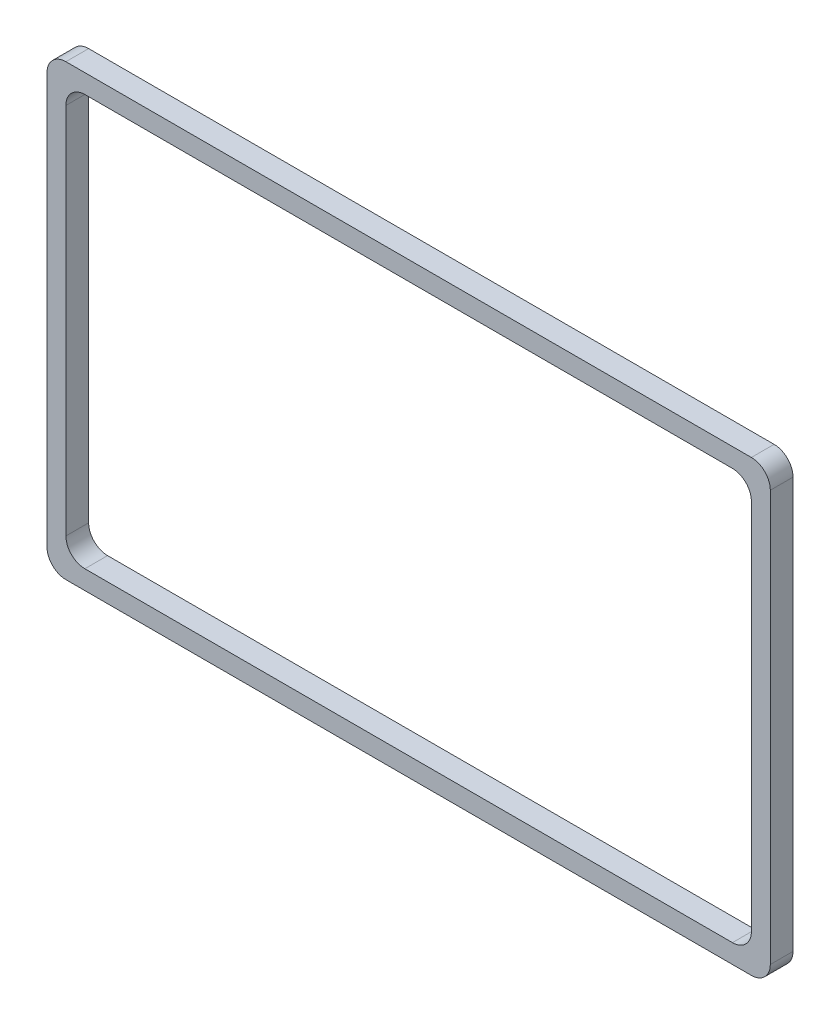
from build123d import *

# Parameters (mm, degrees)
EXTRUDE_1_DEPTH = 12


with BuildPart() as part:
    # 草图1 → 凸台-拉伸1 (new body)
    with BuildSketch(Plane.XY):
        with BuildLine():
            Line((-2.368681364, 195.758648559), (359.631318636, 195.758648559))
            ThreePointArc((359.631318636, 195.758648559), (366.702386448, 192.82971637), (369.631318636, 185.758648559))
            Line((369.631318636, 185.758648559), (369.631318636, -31.141351441))
            ThreePointArc((369.631318636, -31.141351441), (366.702386448, -38.212419253), (359.631318636, -41.141351441))
            Line((359.631318636, -41.141351441), (-2.368681364, -41.141351441))
            ThreePointArc((-2.368681364, -41.141351441), (-9.439749176, -38.212419253), (-12.368681364, -31.141351441))
            Line((-12.368681364, -31.141351441), (-12.368681364, 185.758648559))
            ThreePointArc((-12.368681364, 185.758648559), (-9.439749176, 192.82971637), (-2.368681364, 195.758648559))
        make_face()
        with BuildLine():
            Line((7.631318636, 185.758648559), (349.631318636, 185.758648559))
            ThreePointArc((349.631318636, 185.758648559), (356.702386448, 182.82971637), (359.631318636, 175.758648559))
            Line((359.631318636, 175.758648559), (359.631318636, -21.141351441))
            ThreePointArc((359.631318636, -21.141351441), (356.702386448, -28.212419253), (349.631318636, -31.141351441))
            Line((349.631318636, -31.141351441), (7.631318636, -31.141351441))
            ThreePointArc((7.631318636, -31.141351441), (0.560250824, -28.212419253), (-2.368681364, -21.141351441))
            Line((-2.368681364, -21.141351441), (-2.368681364, 175.758648559))
            ThreePointArc((-2.368681364, 175.758648559), (0.560250824, 182.82971637), (7.631318636, 185.758648559))
        make_face(mode=Mode.SUBTRACT)
    extrude(amount=EXTRUDE_1_DEPTH)


solid = part.part
